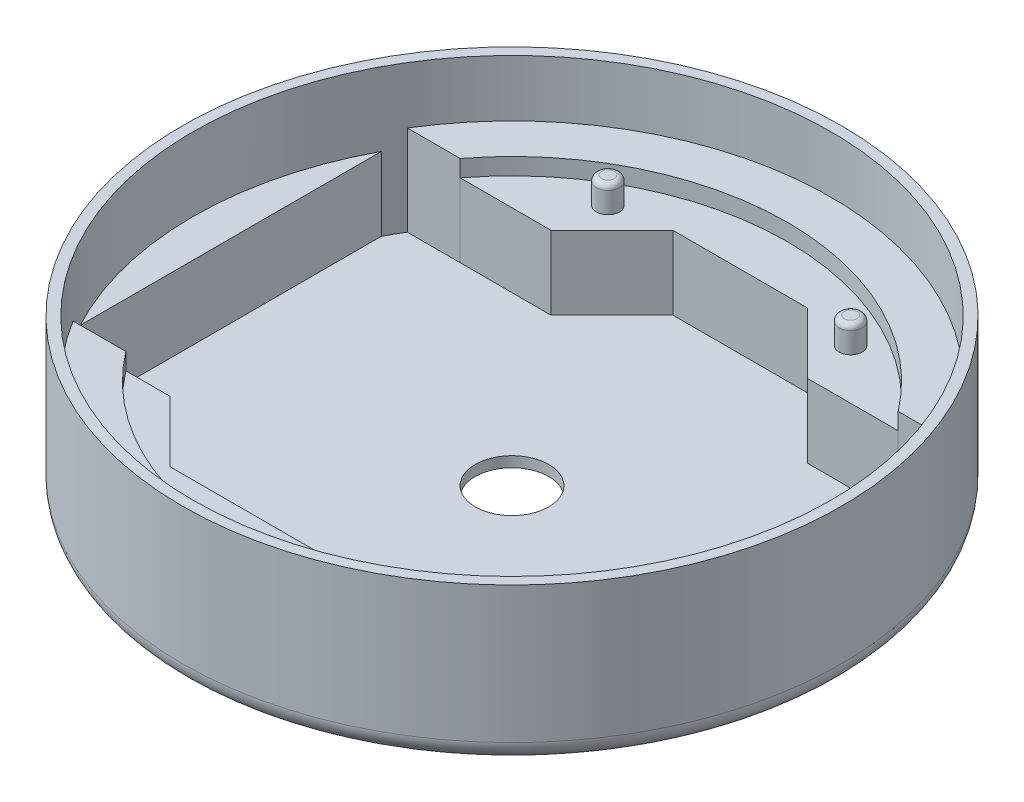
from build123d import *

# Parameters (mm, degrees)
SKETCH1_R           = 31.4
MAIN_CYLINDER_DEPTH = 15
INNER_SHELL_T       = -1
OUTER_BOTTOM_EDGE_R = 2
BOTTOM_HOLE_REACH   = 48.561
SKETCH10_R          = 3.5
MOUNTS_DEPTH        = 7
HOLDER_NORTH_DEPTH  = 1.6
HOLDER_SOUTH_DEPTH  = 1.6
SKETCH17_R          = 1.1
BOSS_EXTRUDE7_DEPTH = 2.5
FILLET1_R           = 0.5


with BuildPart() as part:
    # Sketch1 → Main Cylinder (new body)
    with BuildSketch(Plane(origin=(0, 0, 0), x_dir=(1, 0, 0), z_dir=(0, 1, 0))):
        with Locations(Location((0, 0, 0), (0, 0, 270))):
            Circle(SKETCH1_R)
    extrude(amount=MAIN_CYLINDER_DEPTH)

    # Inner shell
    inner_shell_openings = [part.faces().sort_by_distance(p)[0] for p in [
        (0, 15, 0),
    ]]
    offset(amount=INNER_SHELL_T, openings=inner_shell_openings, kind=Kind.INTERSECTION)

    # Outer bottom edge
    outer_bottom_edge_edges = [part.edges().sort_by_distance(p)[0] for p in [
        (0, 0, -31.4),
    ]]
    fillet(outer_bottom_edge_edges, radius=OUTER_BOTTOM_EDGE_R)

    # Sketch10 → Bottom hole (cut, up to next)
    with BuildSketch(Plane(origin=(0, 1, 0), x_dir=(-1, 0, 0), z_dir=(0, 1, 0)), mode=Mode.PRIVATE) as bottom_hole_sk1:
        with Locations(Location((0, 0, 0), (0, 0, 90))):
            Circle(SKETCH10_R)
    bottom_hole_tool1 = extrude(bottom_hole_sk1.sketch, amount=-BOTTOM_HOLE_REACH, mode=Mode.PRIVATE) & part.part
    add(bottom_hole_tool1.solids().sort_by_distance((0, 1, 0))[0], mode=Mode.SUBTRACT)

    # Sketch12 → Mounts (add)
    with BuildSketch(Plane(origin=(0, 1, 0), x_dir=(1, 0, 0), z_dir=(0, 1, 0))):
        with BuildLine():
            Line((-25.895064684, 15.925), (-12.217281253, 15.925))
            Line((-12.217281253, 15.925), (-6.409281253, 21.733))
            Line((-6.409281253, 21.733), (6.409281253, 21.733))
            Line((6.409281253, 21.733), (12.217281253, 15.925))
            Line((12.217281253, 15.925), (25.895064684, 15.925))
            ThreePointArc((25.895064684, 15.925), (0, 30.4), (-25.895064684, 15.925))
        make_face()
        with BuildLine():
            Line((-10.8458, -21.733200692), (-16.654000692, -15.925))
            Line((-16.654000692, -15.925), (-25.895064684, -15.925))
            ThreePointArc((-25.895064684, -15.925), (0, -30.4), (25.895064684, -15.925))
            Line((25.895064684, -15.925), (16.654000692, -15.925))
            Line((16.654000692, -15.925), (10.8458, -21.733200692))
            Line((10.8458, -21.733200692), (-10.8458, -21.733200692))
        make_face()
        with BuildLine():
            Line((26.8, 14.349912892), (26.8, -14.349912892))
            ThreePointArc((26.8, -14.349912892), (30.4, 0), (26.8, 14.349912892))
        make_face()
        with BuildLine():
            Line((-26.8, 14.349912892), (-26.8, -14.349912892))
            ThreePointArc((-26.8, -14.349912892), (-30.4, 0), (-26.8, 14.349912892))
        make_face()
    extrude(amount=MOUNTS_DEPTH)

    # Sketch14 → Holder (North) (add)
    with BuildSketch(Plane(origin=(0, 8, 0), x_dir=(1, 0, 0), z_dir=(0, 1, 0))):
        with BuildLine():
            Line((-20.86760348, 15.925), (-25.895064684, 15.925))
            ThreePointArc((-25.895064684, 15.925), (0, 30.4), (25.895064684, 15.925))
            Line((25.895064684, 15.925), (20.86760348, 15.925))
            ThreePointArc((20.86760348, 15.925), (0, 26.25), (-20.86760348, 15.925))
        make_face()
    extrude(amount=HOLDER_NORTH_DEPTH)

    # Sketch15 → Holder (South) (add)
    with BuildSketch(Plane(origin=(0, 8, 0), x_dir=(1, 0, 0), z_dir=(0, 1, 0))):
        with BuildLine():
            Line((-20.86760348, -15.925), (-25.895064684, -15.925))
            ThreePointArc((-25.895064684, -15.925), (0, -30.4), (25.895064684, -15.925))
            Line((25.895064684, -15.925), (20.86760348, -15.925))
            ThreePointArc((20.86760348, -15.925), (0, -26.25), (-20.86760348, -15.925))
        make_face()
    extrude(amount=HOLDER_SOUTH_DEPTH)

    # Sketch17 → Boss-Extrude7 (add)
    with BuildSketch(Plane(origin=(0, 8, 0), x_dir=(1, 0, 0), z_dir=(0, 1, 0))):
        with Locations(Location((-11.56, 20.7, 0), (0, 0, 90))):
            Circle(SKETCH17_R)
        with Locations(Location((11.56, 20.7, 0), (0, 0, 90))):
            Circle(SKETCH17_R)
    extrude(amount=BOSS_EXTRUDE7_DEPTH)

    # Fillet1
    fillet1_edges = [part.edges().sort_by_distance(p)[0] for p in [
        (11.56, 10.5, -19.6),
        (-11.56, 10.5, -19.6),
    ]]
    fillet(fillet1_edges, radius=FILLET1_R)


solid = part.part
